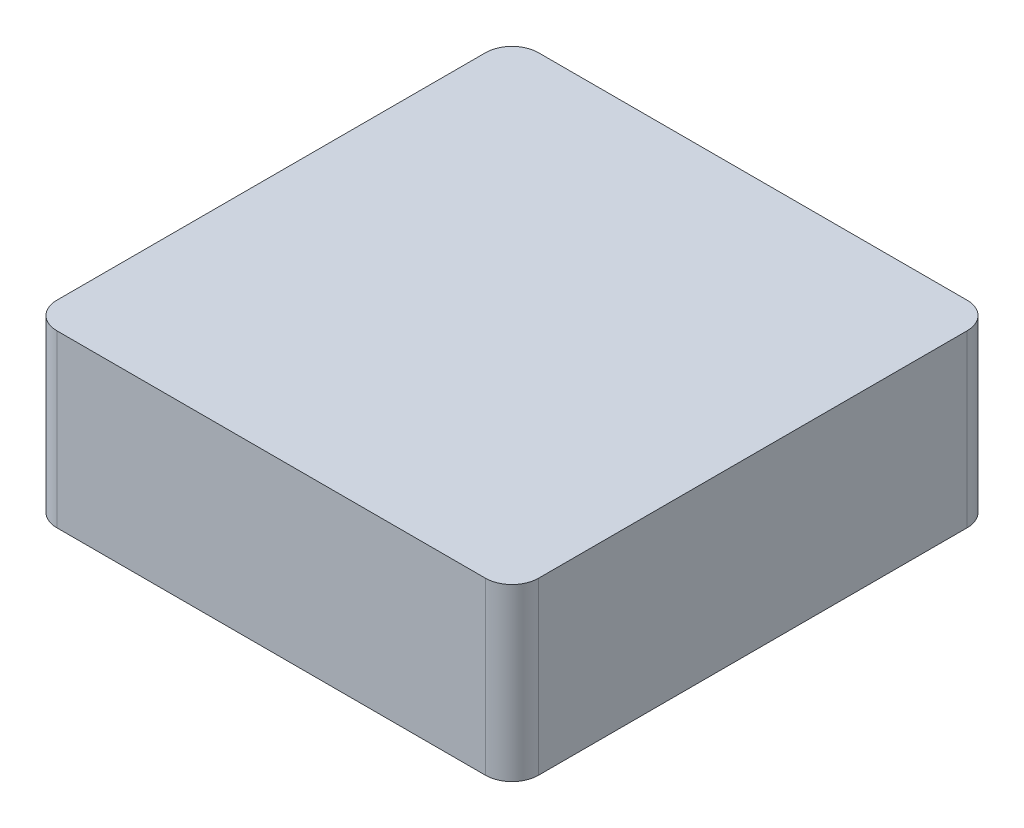
from build123d import *

# Parameters (mm, degrees)
SKETCH1_W           = 127
SKETCH1_H           = 127
BOSS_EXTRUDE1_DEPTH = 45
FILLET1_R           = 7


with BuildPart() as part:
    # Sketch1 → Boss-Extrude1 (new body)
    with BuildSketch(Plane(origin=(0, 0, 0), x_dir=(1, 0, 0), z_dir=(0, 1, 0))):
        with Locations((63.5, 63.5)):
            Rectangle(SKETCH1_W, SKETCH1_H)
    extrude(amount=BOSS_EXTRUDE1_DEPTH)

    # Fillet1
    fillet1_edges = [part.edges().sort_by_distance(p)[0] for p in [
        (0, 22.5, -127),
        (127, 22.5, -127),
        (127, 22.5, 0),
        (0, 22.5, 0),
    ]]
    fillet(fillet1_edges, radius=FILLET1_R)


solid = part.part
